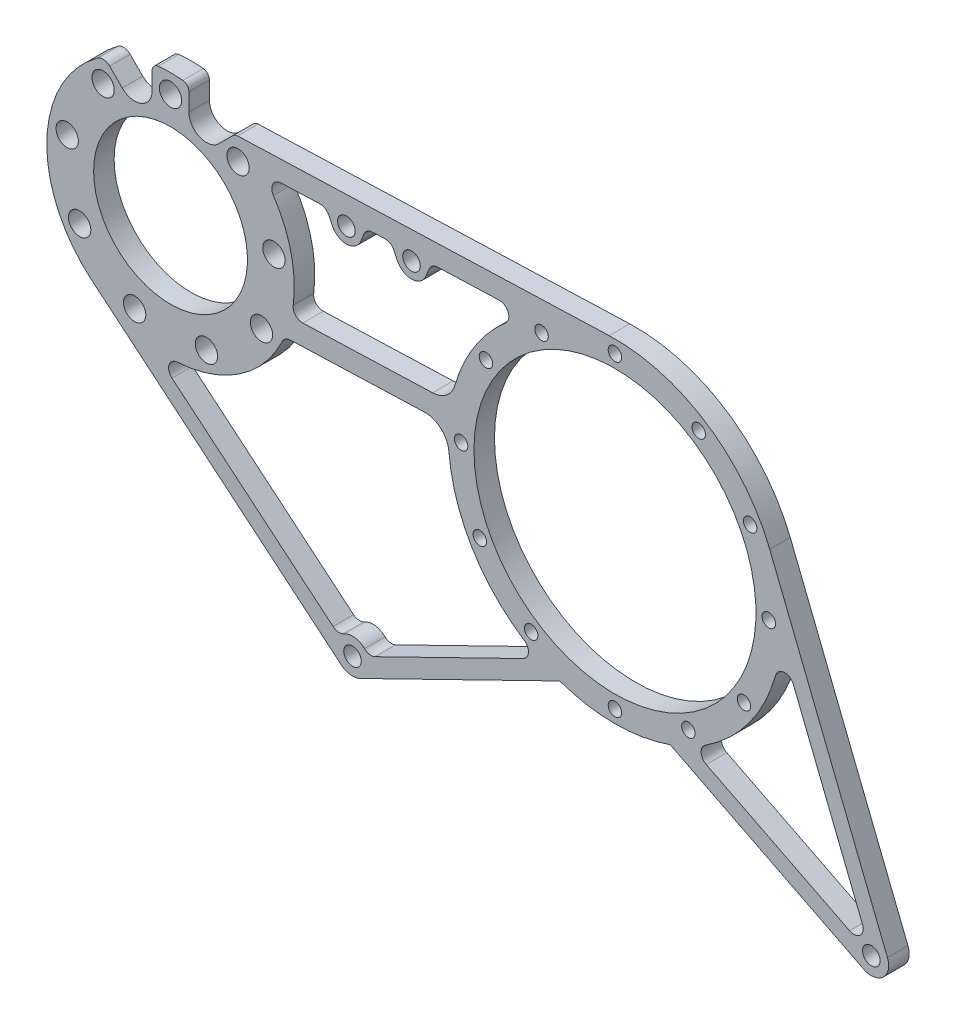
from build123d import *
from build123d.topology import SkipClean

# Parameters (mm, degrees)
SKETCH2_R               = 28.575
SKETCH2_R_2             = 3.2639
SKETCH2_R_3             = 52.3875
BOSS_EXTRUDE1_DEPTH     = 7.62
CUT_EXTRUDE1_DEPTH      = 369.573342704
CUT_EXTRUDE1_DEPTH_BACK = 369.573342704
SKETCH3_R               = 4.15
SKETCH3_R_2             = 2.5
CUT_EXTRUDE2_DEPTH      = 369.573342704
CUT_EXTRUDE2_DEPTH_BACK = 369.573342704
BOSS_EXTRUDE2_DEPTH     = 7.62
CUT_EXTRUDE3_DEPTH      = 369.573342704
CUT_EXTRUDE3_DEPTH_BACK = 369.573342704
SKETCH12_R              = 3.2639


with BuildPart() as part:
    # Sketch2 → Boss-Extrude1 (new body)
    with BuildSketch(Plane.XY):
        with BuildLine():
            Line((-308.866129262, 91.710399516), (-215.926365234, 14.107506231))
            ThreePointArc((-215.926365234, 14.107506231), (-212.572921228, 12.657721799), (-208.970475069, 13.265869211))
            Line((-208.970475069, 13.265869211), (-134.814952137, 49.535152614))
            ThreePointArc((-134.814952137, 49.535152614), (-114.3, 46.0375), (-93.785047863, 49.535152614))
            Line((-93.785047863, 49.535152614), (-21.949808906, 13.301039962))
            ThreePointArc((-21.949808906, 13.301039962), (-14.699565425, 14.303090245), (-13.070560605, 21.438668609))
            Line((-13.070560605, 21.438668609), (-56.805390428, 130.917967399))
            ThreePointArc((-56.805390428, 130.917967399), (-80.468257666, 159.801430712), (-116.436314755, 169.825631839))
            Line((-116.436314755, 169.825631839), (-254.491729173, 165.059137987))
            ThreePointArc((-254.491729173, 165.059137987), (-255.416448823, 164.850182772), (-256.200136715, 164.316701751))
            Line((-256.200136715, 164.316701751), (-261.465020333, 159.051818133))
            ThreePointArc((-261.465020333, 159.051818133), (-268.548656721, 157.642795249), (-272.56121441, 163.648012211))
            Line((-272.56121441, 163.648012211), (-272.56121441, 170.220745001))
            ThreePointArc((-272.56121441, 170.220745001), (-273.218379704, 171.925600851), (-274.84982344, 172.748273949))
            ThreePointArc((-274.84982344, 172.748273949), (-279.4, 172.974), (-283.95017656, 172.748273949))
            ThreePointArc((-283.95017656, 172.748273949), (-285.581620296, 171.925600851), (-286.23878559, 170.220745001))
            Line((-286.23878559, 170.220745001), (-286.23878559, 163.648012211))
            ThreePointArc((-286.23878559, 163.648012211), (-290.251343279, 157.642795249), (-297.334979667, 159.051818133))
            Line((-297.334979667, 159.051818133), (-302.027964646, 163.744803112))
            ThreePointArc((-302.027964646, 163.744803112), (-304.229986022, 164.757469568), (-306.560860086, 164.09307692))
            ThreePointArc((-306.560860086, 164.09307692), (-325.350701602, 128.463454238), (-308.866129262, 91.710399516))
        make_face()
        with Locations(Location((-279.4, 127, 0), (0, 0, 180))):
            Circle(SKETCH2_R, mode=Mode.SUBTRACT)
        with Locations(Location((-19.05, 19.05, 0), (0, 0, 180))):
            Circle(SKETCH2_R_2, mode=Mode.SUBTRACT)
        with Locations(Location((-211.799479175, 19.05, 0), (0, 0, 180))):
            Circle(SKETCH2_R_2, mode=Mode.SUBTRACT)
        with Locations(Location((-114.3, 107.95, 0), (0, 0, 180))):
            Circle(SKETCH2_R_3, mode=Mode.SUBTRACT)
    extrude(amount=BOSS_EXTRUDE1_DEPTH)

    # Sketch3 → Cut-Extrude1 (cut, two sides: drawn at the far end of the back side and taken through both)
    with BuildSketch(Plane.XY.offset(7.62).offset(-CUT_EXTRUDE1_DEPTH_BACK)):
        with Locations((-279.4, 166)):
            Circle(SKETCH3_R)
        with Locations((-254.331283222, 156.875733282)):
            Circle(SKETCH3_R)
        with Locations((-240.992497633, 133.772278929)):
            Circle(SKETCH3_R)
        with Locations((-245.625009252, 107.5)):
            Circle(SKETCH3_R)
        with Locations((-266.06121441, 90.351987789)):
            Circle(SKETCH3_R)
        with Locations((-292.73878559, 90.351987789)):
            Circle(SKETCH3_R)
        with Locations((-313.174990748, 107.5)):
            Circle(SKETCH3_R)
        with Locations((-317.807502367, 133.772278929)):
            Circle(SKETCH3_R)
        with Locations((-304.468716778, 156.875733282)):
            Circle(SKETCH3_R)
        with Locations((-114.3, 165.1)):
            Circle(SKETCH3_R_2)
        with Locations((-57.15, 107.95)):
            Circle(SKETCH3_R_2)
        with Locations((-114.3, 50.8)):
            Circle(SKETCH3_R_2)
        with Locations((-171.45, 107.95)):
            Circle(SKETCH3_R_2)
        with Locations((-83.173879149, 155.880022958)):
            Circle(SKETCH3_R_2)
        with Locations((-64.075602011, 135.219623149)):
            Circle(SKETCH3_R_2)
        with Locations((-66.369977042, 76.823879149)):
            Circle(SKETCH3_R_2)
        with Locations((-87.030376851, 57.725602011)):
            Circle(SKETCH3_R_2)
        with Locations((-145.426120851, 60.019977042)):
            Circle(SKETCH3_R_2)
        with Locations((-164.524397989, 80.680376851)):
            Circle(SKETCH3_R_2)
        with Locations((-162.230022958, 139.076120851)):
            Circle(SKETCH3_R_2)
        with Locations((-141.569623149, 158.174397989)):
            Circle(SKETCH3_R_2)
    extrude(amount=CUT_EXTRUDE1_DEPTH + CUT_EXTRUDE1_DEPTH_BACK, mode=Mode.SUBTRACT)

    # Sketch4 → Cut-Extrude2 (cut, two sides: drawn at the far end of the back side and taken through both)
    with BuildSketch(Plane.XY.offset(7.62).offset(-CUT_EXTRUDE2_DEPTH_BACK)):
        with BuildLine():
            Line((-278.862624236, 74.930604639), (-219.018129111, 24.961616472))
            ThreePointArc((-219.018129111, 24.961616472), (-217.07692299, 24.16262829), (-215.028330647, 24.620812453))
            ThreePointArc((-215.028330647, 24.620812453), (-211.026037121, 25.442278201), (-207.335161059, 23.689967346))
            ThreePointArc((-207.335161059, 23.689967346), (-205.454963796, 22.756414152), (-203.379217054, 23.069365873))
            Line((-203.379217054, 23.069365873), (-148.393096208, 49.962941986))
            ThreePointArc((-148.393096208, 49.962941986), (-146.441473652, 52.888826728), (-148.025123052, 56.029158988))
            ThreePointArc((-148.025123052, 56.029158988), (-167.425190554, 76.155790074), (-175.994929719, 102.764124644))
            ThreePointArc((-175.994929719, 102.764124644), (-178.950352695, 108.666494642), (-185.160441746, 110.904192242))
            Line((-185.160441746, 110.904192242), (-234.876032851, 109.187714403))
            ThreePointArc((-234.876032851, 109.187714403), (-236.669637565, 108.61854745), (-237.907571885, 107.201336279))
            ThreePointArc((-237.907571885, 107.201336279), (-253.78883961, 88.82046177), (-276.820157686, 81.098441316))
            ThreePointArc((-276.820157686, 81.098441316), (-279.939618833, 78.709346862), (-278.862624236, 74.930604639))
        make_face()
        with BuildLine():
            Line((-48.019318761, 91.807143198), (-22.303873454, 27.434904147))
            ThreePointArc((-22.303873454, 27.434904147), (-23.187455951, 23.564521405), (-27.120033775, 23.021003007))
            Line((-27.120033775, 23.021003007), (-80.387932313, 49.889641079))
            ThreePointArc((-80.387932313, 49.889641079), (-82.302626367, 52.822384958), (-80.709884678, 55.941714036))
            ThreePointArc((-80.709884678, 55.941714036), (-64.405072396, 71.294115674), (-54.62867895, 91.442695545))
            ThreePointArc((-54.62867895, 91.442695545), (-51.454892751, 93.998716793), (-48.019318761, 91.807143198))
        make_face()
        with BuildLine():
            Line((-238.402359266, 157.990098388), (-157.34562354, 160.788658909))
            ThreePointArc((-157.34562354, 160.788658909), (-153.975579676, 158.578116117), (-154.932995767, 154.663138529))
            ThreePointArc((-154.932995767, 154.663138529), (-166.508163426, 141.228601653), (-173.800186524, 125.063896689))
            ThreePointArc((-173.800186524, 125.063896689), (-176.874809559, 120.512552862), (-182.037050163, 118.636570616))
            Line((-182.037050163, 118.636570616), (-230.24689137, 116.972080217))
            ThreePointArc((-230.24689137, 116.972080217), (-232.955010122, 118.116900866), (-233.829266544, 120.924069761))
            ThreePointArc((-233.829266544, 120.924069761), (-234.620613955, 137.412264953), (-241.184927886, 152.558109071))
            ThreePointArc((-241.184927886, 152.558109071), (-241.390248986, 156.091974283), (-238.402359266, 157.990098388))
        make_face()
    extrude(amount=CUT_EXTRUDE2_DEPTH + CUT_EXTRUDE2_DEPTH_BACK, mode=Mode.SUBTRACT)

    # Sketch11 → Boss-Extrude2 (add)
    with BuildSketch(Plane(origin=(0, 0, 0), x_dir=(-1, 0, 0), z_dir=(0, 0, -1))):
        with BuildLine():
            Line((207.527120949, 156.980199935), (208.688714257, 154.101435278))
            ThreePointArc((208.688714257, 154.101435278), (213.870721133, 150.472754139), (219.290640683, 153.735420862))
            Line((219.290640683, 153.735420862), (220.647990696, 156.527200807))
            ThreePointArc((220.647990696, 156.527200807), (221.987721601, 157.992282798), (223.909468964, 158.49051087))
            Line((223.909468964, 158.49051087), (221.735746538, 158.565579296))
            Line((221.735746538, 158.565579296), (216.188353984, 158.757094079))
            ThreePointArc((216.188353984, 158.757094079), (213.958358328, 153.011241823), (212.129932329, 158.897204543))
            Line((212.129932329, 158.897204543), (206.582539776, 159.088719327))
            Line((206.582539776, 159.088719327), (204.408842654, 159.163760977))
            ThreePointArc((204.408842654, 159.163760977), (206.291633306, 158.534177501), (207.527120949, 156.980199935))
        make_face()
        with BuildLine():
            ThreePointArc((199.725649115, 159.325448413), (197.803922582, 158.827213892), (196.464204543, 157.362145264))
            Line((196.464204543, 157.362145264), (195.106835972, 154.570345104))
            ThreePointArc((195.106835972, 154.570345104), (189.686908084, 151.307692234), (184.504910482, 154.936386616))
            Line((184.504910482, 154.936386616), (183.343323694, 157.815156094))
            ThreePointArc((183.343323694, 157.815156094), (182.107841163, 159.369135959), (180.225053803, 159.998724924))
            Line((180.225053803, 159.998724924), (182.398748746, 159.923676049))
            Line((182.398748746, 159.923676049), (187.94614081, 159.732147087))
            ThreePointArc((187.94614081, 159.732147087), (189.774551766, 153.846179694), (192.004562108, 159.59202625))
            Line((192.004562108, 159.59202625), (197.551954171, 159.400497289))
            Line((197.551954171, 159.400497289), (199.725649115, 159.325448413))
        make_face()
    extrude(amount=-BOSS_EXTRUDE2_DEPTH)

    # Sketch12 → Cut-Extrude3 (cut, two sides: drawn at the far end of the back side and taken through both)
    with SkipClean():  # the faces are left unmerged after this step: merging them gives an invalid solid
        with BuildSketch(Plane(origin=(0, 0, 0), x_dir=(-1, 0, 0), z_dir=(0, 0, -1)).offset(-CUT_EXTRUDE3_DEPTH_BACK)):
            with Locations((189.887173898, 157.10813608)):
                Circle(SKETCH12_R)
            with Locations((214.070972123, 156.273198497)):
                Circle(SKETCH12_R)
        extrude(amount=CUT_EXTRUDE3_DEPTH + CUT_EXTRUDE3_DEPTH_BACK, mode=Mode.SUBTRACT)


solid = part.part
